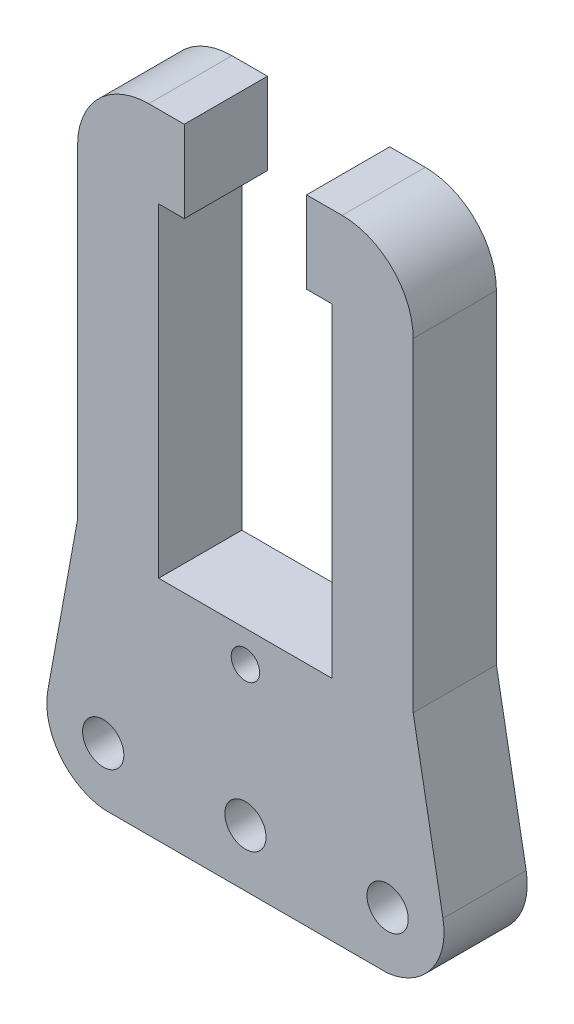
from build123d import *

# Parameters (mm, degrees)
MODEL_R             = 1.45
MODEL_R_2           = 1
BOSS_EXTRUDE1_DEPTH = 5.85


with BuildPart() as part:
    # Model → Boss-Extrude1 (new body)
    with BuildSketch(Plane.XY):
        with BuildLine():
            Line((508.182236888, 554.934833401), (506.087301785, 543.461595882))
            ThreePointArc((506.087301785, 543.461595882), (506.893587564, 539.980874482), (509.982236888, 538.184833401))
            Line((509.982236888, 538.184833401), (529.982236888, 538.184833401))
            ThreePointArc((529.982236888, 538.184833401), (533.070886212, 539.980874482), (533.877171991, 543.461595882))
            Line((533.877171991, 543.461595882), (531.782236888, 554.934833401))
            Line((531.782236888, 554.934833401), (531.782236888, 577.734833401))
            ThreePointArc((531.782236888, 577.734833401), (530.317770794, 581.270367307), (526.782236888, 582.734833401))
            Line((526.782236888, 582.734833401), (524.282236888, 582.734833401))
            Line((524.282236888, 582.734833401), (524.282236888, 576.984833401))
            Line((524.282236888, 576.984833401), (526.082236888, 576.984833401))
            Line((526.082236888, 576.984833401), (526.082236888, 554.184833401))
            Line((526.082236888, 554.184833401), (513.882236888, 554.184833401))
            Line((513.882236888, 554.184833401), (513.882236888, 576.984833401))
            Line((513.882236888, 576.984833401), (515.682236888, 576.984833401))
            Line((515.682236888, 576.984833401), (515.682236888, 582.734833401))
            Line((515.682236888, 582.734833401), (513.182236888, 582.734833401))
            ThreePointArc((513.182236888, 582.734833401), (509.646702982, 581.270367307), (508.182236888, 577.734833401))
            Line((508.182236888, 577.734833401), (508.182236888, 554.934833401))
        make_face()
        with Locations(Location((509.982236888, 542.184833401, 0), (0, 0, 180))):
            Circle(MODEL_R, mode=Mode.SUBTRACT)
        with Locations((519.982236888, 542.184833401)):
            Circle(MODEL_R, mode=Mode.SUBTRACT)
        with Locations((529.982236888, 542.184833401)):
            Circle(MODEL_R, mode=Mode.SUBTRACT)
        with Locations((519.982236888, 551.984833401)):
            Circle(MODEL_R_2, mode=Mode.SUBTRACT)
    extrude(amount=BOSS_EXTRUDE1_DEPTH)


solid = part.part
